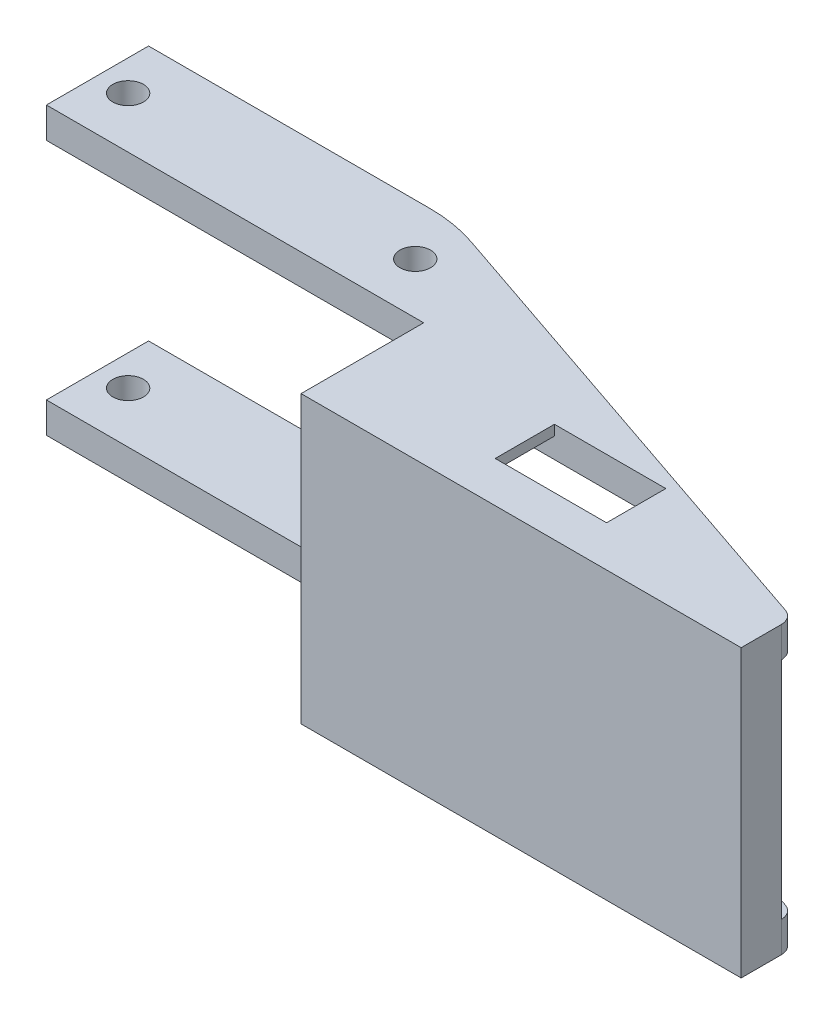
from build123d import *

# Parameters (mm, degrees)
BOSS_EXTRUDE1_DEPTH                      = 3
BOSS_EXTRUDE2_START                      = 22
BOSS_EXTRUDE2_DEPTH                      = 3
SKETCH3_W                                = 1.5
SKETCH3_H                                = 28
F_3_0MM_CLEARANCE_DOWEL_HOLE1_AT_2_COUNT = 2
F_3_0MM_CLEARANCE_DOWEL_HOLE1_AT_2_PITCH = 28.1
SKETCH5_W                                = 43.073811931
SKETCH5_H                                = 3.925670489
BOSS_EXTRUDE3_DEPTH                      = 22
SKETCH6_W                                = 12.9
SKETCH6_H                                = 5.8
CUT_EXTRUDE1_DEPTH                       = 10
SKETCH7_W                                = 5.8
SKETCH7_H                                = 1
BOSS_EXTRUDE4_DEPTH                      = 2


with BuildPart() as part:
    # Sketch1 → Boss-Extrude1 (new body)
    with BuildSketch(Plane(origin=(0, 0, 0), x_dir=(1, 0, 0), z_dir=(0, 1, 0))):
        with BuildLine():
            Line((-4.577926811, 9.356292891), (42.056666031, -6.499468675))
            ThreePointArc((42.056666031, -6.499468675), (42.793295664, -7.04620955), (43.073811931, -7.919627792))
            Line((43.073811931, -7.919627792), (43.073811931, -11.845298281))
            Line((43.073811931, -11.845298281), (0, -11.845298281))
            Line((0, -11.845298281), (0, 0.154701719))
            Line((0, 0.154701719), (-36.926188069, 0.154701719))
            Line((-36.926188069, 0.154701719), (-36.926188069, 10.154701719))
            Line((-36.926188069, 10.154701719), (-9.406467809, 10.154701719))
            ThreePointArc((-9.406467809, 10.154701719), (-6.959415254, 9.953753506), (-4.577926811, 9.356292891))
        make_face()
    extrude(amount=-BOSS_EXTRUDE1_DEPTH)


with BuildPart() as body_2:
    # Sketch1<2> → Boss-Extrude2 (new body)
    with BuildSketch(Plane(origin=(0, 0, 0), x_dir=(1, 0, 0), z_dir=(0, 1, 0)).offset(BOSS_EXTRUDE2_START)):
        with BuildLine():
            Line((-4.577926811, 9.356292891), (42.056666031, -6.499468675))
            ThreePointArc((42.056666031, -6.499468675), (42.793295664, -7.04620955), (43.073811931, -7.919627792))
            Line((43.073811931, -7.919627792), (43.073811931, -11.845298281))
            Line((43.073811931, -11.845298281), (0, -11.845298281))
            Line((0, -11.845298281), (0, 0.154701719))
            Line((0, 0.154701719), (-36.926188069, 0.154701719))
            Line((-36.926188069, 0.154701719), (-36.926188069, 10.154701719))
            Line((-36.926188069, 10.154701719), (-9.406467809, 10.154701719))
            ThreePointArc((-9.406467809, 10.154701719), (-6.959415254, 9.953753506), (-4.577926811, 9.356292891))
        make_face()
    extrude(amount=BOSS_EXTRUDE2_DEPTH)


with BuildPart() as f_3_0mm_clearance_dowel_hole1_tool:
    # Sketch3 → Ø3.0mm Clearance Dowel Hole1 (revolve)
    with BuildSketch(Plane(origin=(-33.926188069, -3, -5.154701719), x_dir=(0, 0, -1), z_dir=(1, 0, 0))):
        with Locations((0.75, 14)):
            Rectangle(SKETCH3_W, SKETCH3_H)
    f_3_0mm_clearance_dowel_hole1 = revolve(axis=Axis((-33.926188069, -9.35, -5.154701719), (0, 1, 0)))


with BuildPart() as part_1:
    add(part.part)

    # Ø3.0mm Clearance Dowel Hole1: cut by f_3_0mm_clearance_dowel_hole1_tool
    add(f_3_0mm_clearance_dowel_hole1_tool.part, mode=Mode.SUBTRACT)


with BuildPart() as body_2_1:
    add(body_2.part)

    # Ø3.0mm Clearance Dowel Hole1: cut by f_3_0mm_clearance_dowel_hole1_tool
    add(f_3_0mm_clearance_dowel_hole1_tool.part, mode=Mode.SUBTRACT)


with BuildPart() as f_3_0mm_clearance_dowel_hole1_at_2_tool:
    # Ø3.0mm Clearance Dowel Hole1 at 2: Ø3.0mm Clearance Dowel Hole1 ×2
    with Locations(*[(i * F_3_0MM_CLEARANCE_DOWEL_HOLE1_AT_2_PITCH, 0, 0) for i in range(1, F_3_0MM_CLEARANCE_DOWEL_HOLE1_AT_2_COUNT)]):
        add(f_3_0mm_clearance_dowel_hole1)


with BuildPart() as part_2:
    add(part_1.part)

    # Ø3.0mm Clearance Dowel Hole1 at 2: cut by f_3_0mm_clearance_dowel_hole1_at_2_tool
    add(f_3_0mm_clearance_dowel_hole1_at_2_tool.part, mode=Mode.SUBTRACT)



with BuildPart() as body_2_2:
    add(body_2_1.part)

    # Ø3.0mm Clearance Dowel Hole1 at 2: cut by f_3_0mm_clearance_dowel_hole1_at_2_tool
    add(f_3_0mm_clearance_dowel_hole1_at_2_tool.part, mode=Mode.SUBTRACT)


with BuildPart() as part_3:
    add(part_2.part)

    add(body_2_2.part)  # Boss-Extrude3 merges body 2
    # Sketch5 → Boss-Extrude3 (add)
    with BuildSketch(Plane(origin=(0, 0, 0), x_dir=(1, 0, 0), z_dir=(0, 1, 0))):
        with Locations((21.536905966, -9.882463037)):
            Rectangle(SKETCH5_W, SKETCH5_H)
    extrude(amount=BOSS_EXTRUDE3_DEPTH)

    # Sketch6 → Cut-Extrude1 (cut)
    with BuildSketch(Plane(origin=(0, 25, 0), x_dir=(1, 0, 0), z_dir=(0, 1, 0))):
        with Locations((19.45, -4.945298281)):
            Rectangle(SKETCH6_W, SKETCH6_H)
    extrude(amount=-CUT_EXTRUDE1_DEPTH, mode=Mode.SUBTRACT)

    # Sketch7 → Boss-Extrude4 (add)
    with BuildSketch(Plane(origin=(13, 0, 0), x_dir=(0, 0, -1), z_dir=(1, 0, 0))):
        with Locations((-4.945298281, 24.5)):
            Rectangle(SKETCH7_W, SKETCH7_H)
    extrude(amount=BOSS_EXTRUDE4_DEPTH)


solid = part_3.part
